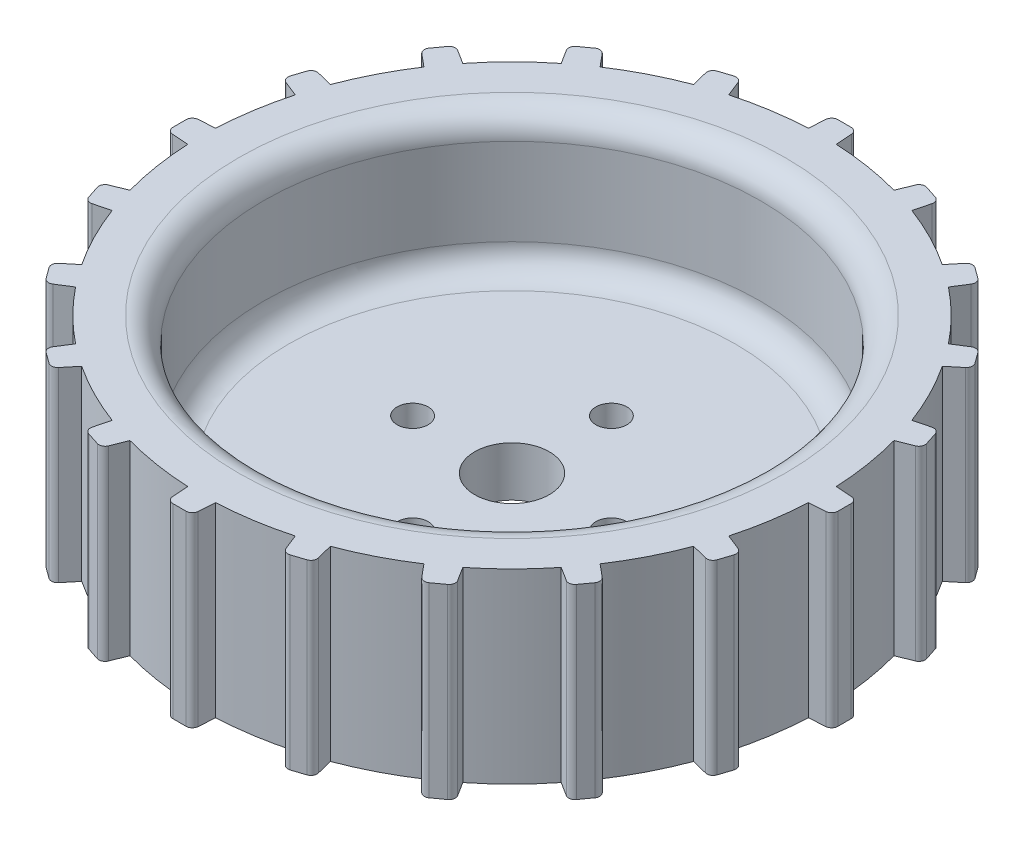
from build123d import *

# Parameters (mm, degrees)
SKETCH1_R           = 25
SKETCH1_R_2         = 3
SKETCH1_R_3         = 1.25
BOSS_EXTRUDE1_DEPTH = 15
SKETCH2_R           = 20
CUT_EXTRUDE1_DEPTH  = 11
FILLET1_R           = 2
BOSS_EXTRUDE2_DEPTH = 15
CIRPATTERN1_COUNT   = 20


with BuildPart() as part:
    # Sketch1 → Boss-Extrude1 (new body)
    with BuildSketch(Plane(origin=(0, 0, 0), x_dir=(1, 0, 0), z_dir=(0, 1, 0))):
        with Locations(Location((0, 0, 0), (0, 0, 270))):
            Circle(SKETCH1_R)
        with Locations(Location((0, 0, 0), (0, 0, 270))):
            Circle(SKETCH1_R_2, mode=Mode.SUBTRACT)
        with Locations(Location((0, 8, 0), (0, 0, 270))):
            Circle(SKETCH1_R_3, mode=Mode.SUBTRACT)
        with Locations(Location((8, 0, 0), (0, 0, 270))):
            Circle(SKETCH1_R_3, mode=Mode.SUBTRACT)
        with Locations(Location((0, -8, 0), (0, 0, 270))):
            Circle(SKETCH1_R_3, mode=Mode.SUBTRACT)
        with Locations(Location((-8, 0, 0), (0, 0, 270))):
            Circle(SKETCH1_R_3, mode=Mode.SUBTRACT)
    extrude(amount=BOSS_EXTRUDE1_DEPTH)

    # Sketch2 → Cut-Extrude1 (cut)
    with BuildSketch(Plane(origin=(0, 15, 0), x_dir=(1, 0, 0), z_dir=(0, 1, 0))):
        with Locations(Location((0, 0, 0), (0, 0, 270))):
            Circle(SKETCH2_R)
    extrude(amount=-CUT_EXTRUDE1_DEPTH, mode=Mode.SUBTRACT)

    # Fillet1
    fillet1_edges = [part.edges().sort_by_distance(p)[0] for p in [
        (0, 4, -20),
        (0, 15, -20),
    ]]
    fillet(fillet1_edges, radius=FILLET1_R)

    # Sketch3 → Boss-Extrude2 (add)
    with BuildSketch(Plane.XZ):
        with BuildLine():
            Line((1.175860097, -24.094064846), (1.034143555, -26.297367496))
            ThreePointArc((1.034143555, -26.297367496), (0.877193006, -26.629997556), (0.535174624, -26.765273788))
            Line((0.535174624, -26.765273788), (-0.535174624, -26.765273788))
            ThreePointArc((-0.535174624, -26.765273788), (-0.877193006, -26.629997556), (-1.034143555, -26.297367496))
            Line((-1.034143555, -26.297367496), (-1.175860097, -24.094064846))
            Line((-1.175860097, -24.094064846), (1.175860097, -24.094064846))
        make_face()
    boss_extrude2 = extrude(amount=-BOSS_EXTRUDE2_DEPTH)

    # CirPattern1: Boss-Extrude2 ×20 about axis
    cirpattern1_axis = Axis((0, 0, 0), (0, 1, 0))
    for i in range(1, CIRPATTERN1_COUNT):
        add(boss_extrude2.rotate(cirpattern1_axis, i * 360 / CIRPATTERN1_COUNT))


solid = part.part
